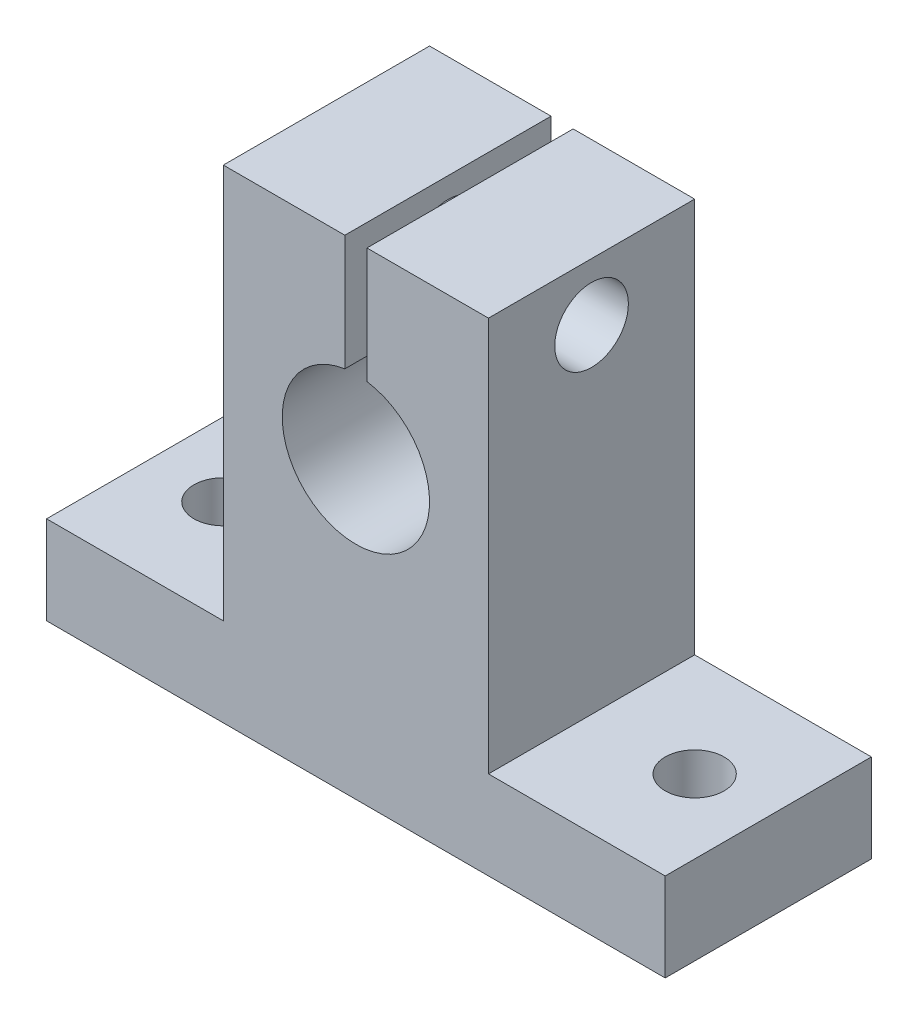
from build123d import *

# Parameters (mm, degrees)
BOSS_EXTRUDE1_DEPTH = 14
SKETCH2_R           = 2.5
CUT_EXTRUDE1_DEPTH  = 37.945365068
SKETCH3_R           = 2
CUT_EXTRUDE2_DEPTH  = 14


with BuildPart() as part:
    # Sketch1 → Boss-Extrude1 (new body)
    with BuildSketch(Plane.XY):
        with BuildLine():
            Line((-21, -16.4), (21, -16.4))
            Line((21, -16.4), (21, -10.4))
            Line((21, -10.4), (9, -10.4))
            Line((9, -10.4), (9, 16.4))
            Line((9, 16.4), (0.75, 16.4))
            Line((0.75, 16.4), (0.75, 8.543429983))
            ThreePointArc((0.75, 8.543429983), (0, -1.4), (-0.75, 8.543429983))
            Line((-0.75, 8.543429983), (-0.75, 16.4))
            Line((-0.75, 16.4), (-9, 16.4))
            Line((-9, 16.4), (-9, -10.4))
            Line((-9, -10.4), (-21, -10.4))
            Line((-21, -10.4), (-21, -16.4))
        make_face()
    extrude(amount=BOSS_EXTRUDE1_DEPTH)

    # Sketch2 → Cut-Extrude1 (cut, through all)
    with BuildSketch(Plane(origin=(9, 0, 0), x_dir=(0, 0, -1), z_dir=(1, 0, 0))):
        with Locations((-7, 12.5)):
            Circle(SKETCH2_R)
    extrude(amount=-CUT_EXTRUDE1_DEPTH, mode=Mode.SUBTRACT)

    # Sketch3 → Cut-Extrude2 (cut)
    with BuildSketch(Plane(origin=(0, -10.4, 0), x_dir=(1, 0, 0), z_dir=(0, 1, 0))):
        with Locations(Location((-16, -7, 0), (0, 0, 180))):
            Circle(SKETCH3_R)
        with Locations(Location((16, -7, 0), (0, 0, 180))):
            Circle(SKETCH3_R)
    extrude(amount=-CUT_EXTRUDE2_DEPTH, mode=Mode.SUBTRACT)


solid = part.part
